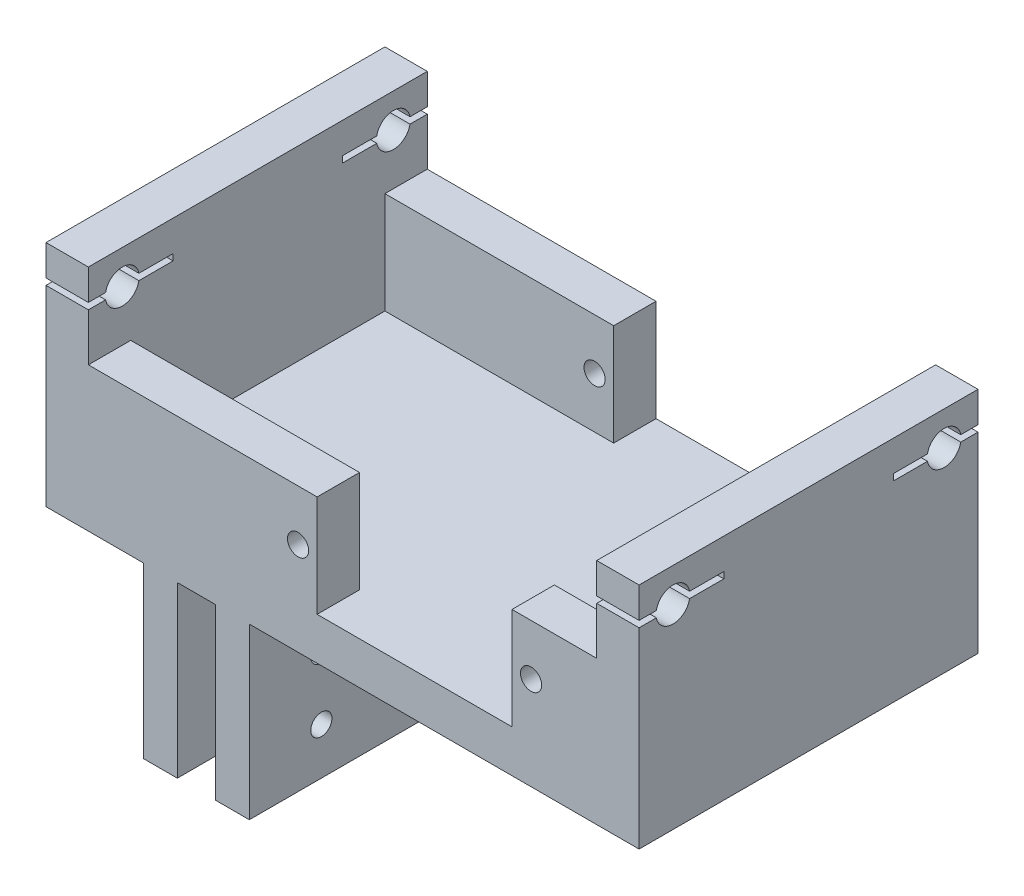
from build123d import *

# Parameters (mm, degrees)
SKETCH1_W               = 70
SKETCH1_H               = 40
BOSS_EXTRUDE1_DEPTH     = 5
BOSS_EXTRUDE2_DEPTH     = 12
SKETCH3_W               = 5
SKETCH3_H               = 40
BOSS_EXTRUDE3_DEPTH     = 10
SKETCH5_R               = 2
CUT_EXTRUDE1_DEPTH      = 78.646635471
CUT_EXTRUDE3_DEPTH      = 57.382621436
CUT_EXTRUDE3_DEPTH_BACK = 57.382621436
SKETCH7_R               = 1.25
SKETCH8_W               = 10
SKETCH8_H               = 0.75
CUT_EXTRUDE4_DEPTH      = 78.646635471
SKETCH9_W               = 4
SKETCH9_H               = 40
BOSS_EXTRUDE4_DEPTH     = 20
CUT_EXTRUDE5_DEPTH      = 50.727549083
CUT_EXTRUDE5_DEPTH_BACK = 50.727549083
SKETCH11_R              = 1.25


with BuildPart() as part:
    # Sketch1 → Boss-Extrude1 (new body)
    with BuildSketch(Plane(origin=(0, 0, 0), x_dir=(1, 0, 0), z_dir=(0, 1, 0))):
        Rectangle(SKETCH1_W, SKETCH1_H)
    extrude(amount=BOSS_EXTRUDE1_DEPTH)

    # Sketch2 → Boss-Extrude2 (add)
    with BuildSketch(Plane(origin=(0, 5, 0), x_dir=(1, 0, 0), z_dir=(0, 1, 0))):
        Polygon((-3, -20), (-3, -15), (-30, -15), (-30, 15), (-3, 15), (-3, 20), (-35, 20), (-35, -20), align=None)
        Polygon((20, -15), (30, -15), (30, 15), (20, 15), (20, 20), (35, 20), (35, -20), (20, -20), align=None)
    extrude(amount=BOSS_EXTRUDE2_DEPTH)

    # Sketch3 → Boss-Extrude3 (add)
    with BuildSketch(Plane(origin=(0, 17, 0), x_dir=(1, 0, 0), z_dir=(0, 1, 0))):
        with Locations((32.5, 0)):
            Rectangle(SKETCH3_W, SKETCH3_H)
        with Locations((-32.5, 0)):
            Rectangle(SKETCH3_W, SKETCH3_H)
    extrude(amount=BOSS_EXTRUDE3_DEPTH)

    # Sketch5 → Cut-Extrude1 (cut, through all)
    with BuildSketch(Plane.ZY.offset(35)):
        with Locations((16, 23)):
            Circle(SKETCH5_R)
        with Locations(Location((-16, 23, 0), (0, 0, 180))):
            Circle(SKETCH5_R)
    extrude(amount=-CUT_EXTRUDE1_DEPTH, mode=Mode.SUBTRACT)

    # Sketch7 → Cut-Extrude3 (cut, two sides: drawn at the far end of the back side and taken through both)
    with BuildSketch(Plane(origin=(0, 0, 15), x_dir=(-1, 0, 0), z_dir=(0, 0, -1)).offset(-CUT_EXTRUDE3_DEPTH_BACK)):
        with Locations((-22.25, 11)):
            Circle(SKETCH7_R)
        with Locations((5.25, 11)):
            Circle(SKETCH7_R)
    extrude(amount=CUT_EXTRUDE3_DEPTH + CUT_EXTRUDE3_DEPTH_BACK, mode=Mode.SUBTRACT)

    # Sketch8 → Cut-Extrude4 (cut, through all)
    with BuildSketch(Plane.ZY.offset(35)):
        with Locations((15, 23)):
            Rectangle(SKETCH8_W, SKETCH8_H)
        with Locations((-15, 23)):
            Rectangle(SKETCH8_W, SKETCH8_H)
    extrude(amount=-CUT_EXTRUDE4_DEPTH, mode=Mode.SUBTRACT)

    # Sketch9 → Boss-Extrude4 (add)
    with BuildSketch(Plane(origin=(0, 0, 0), x_dir=(-1, 0, 0), z_dir=(0, -1, 0))):
        with Locations((21.5, 0)):
            Rectangle(SKETCH9_W, SKETCH9_H)
        with Locations((13, 0)):
            Rectangle(SKETCH9_W, SKETCH9_H)
    extrude(amount=BOSS_EXTRUDE4_DEPTH)

    # Sketch11 → Cut-Extrude5 (cut, two sides: drawn at the far end of the back side and taken through both)
    with BuildSketch(Plane.ZY.offset(1.658275161).offset(-CUT_EXTRUDE5_DEPTH_BACK)):
        with Locations((11.5, -14.5)):
            Circle(SKETCH11_R)
        with Locations((-16, -14.5)):
            Circle(SKETCH11_R)
        with Locations((-16, -7)):
            Circle(SKETCH11_R)
        with Locations((11.5, -7)):
            Circle(SKETCH11_R)
    extrude(amount=CUT_EXTRUDE5_DEPTH + CUT_EXTRUDE5_DEPTH_BACK, mode=Mode.SUBTRACT)


solid = part.part
